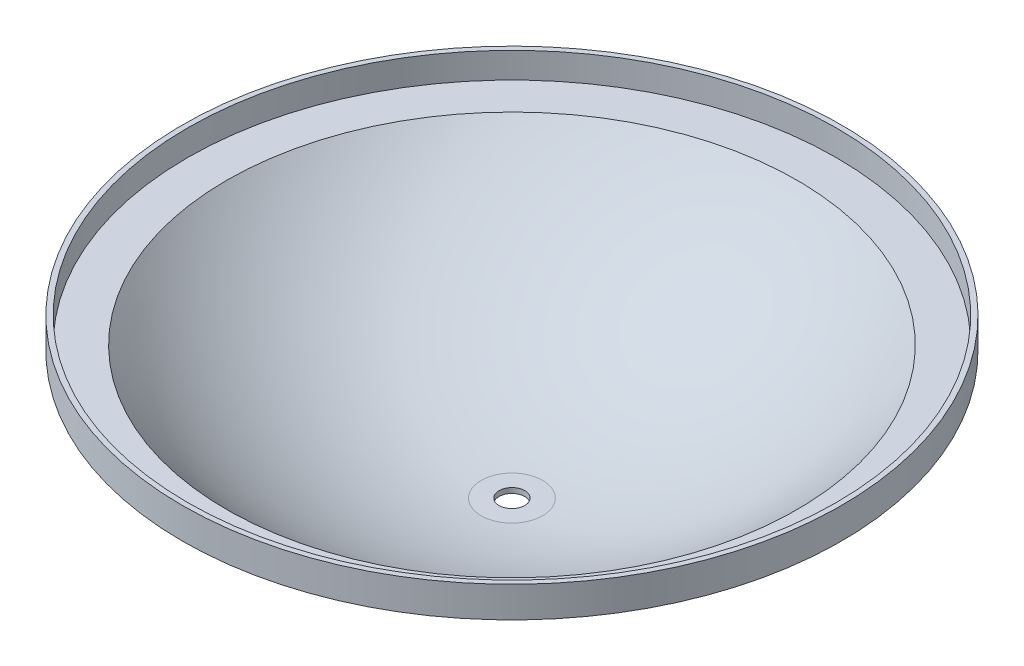
from build123d import *


with BuildPart() as part:
    # Sketch1 → Revolve2 (revolve)
    with BuildSketch(Plane.XY, mode=Mode.PRIVATE) as revolve2_sk:
        with BuildLine():
            Line((-2.5, -72.753006811), (-6, -72.753006811))
            ThreePointArc((-6, -72.753006811), (-33.50186891, -64.858498129), (-55.856960175, -47))
            Line((-55.856960175, -47), (-64, -47))
            Line((-64, -47), (-64, -41))
            Line((-64, -41), (-63, -41))
            Line((-63, -41), (-63, -46))
            Line((-63, -46), (-55.389529697, -46))
            ThreePointArc((-55.389529697, -46), (-33.267182398, -63.853696646), (-5.958692274, -71.753006811))
            Line((-5.958692274, -71.753006811), (-2.5, -71.753006811))
            Line((-2.5, -71.753006811), (-2.5, -72.753006811))
        make_face()
    revolve(revolve2_sk.sketch.rotate(Axis((0, 36.298912202, 0), (0, -1, 0)), 270), axis=Axis((0, 36.298912202, 0), (0, -1, 0)))


solid = part.part
